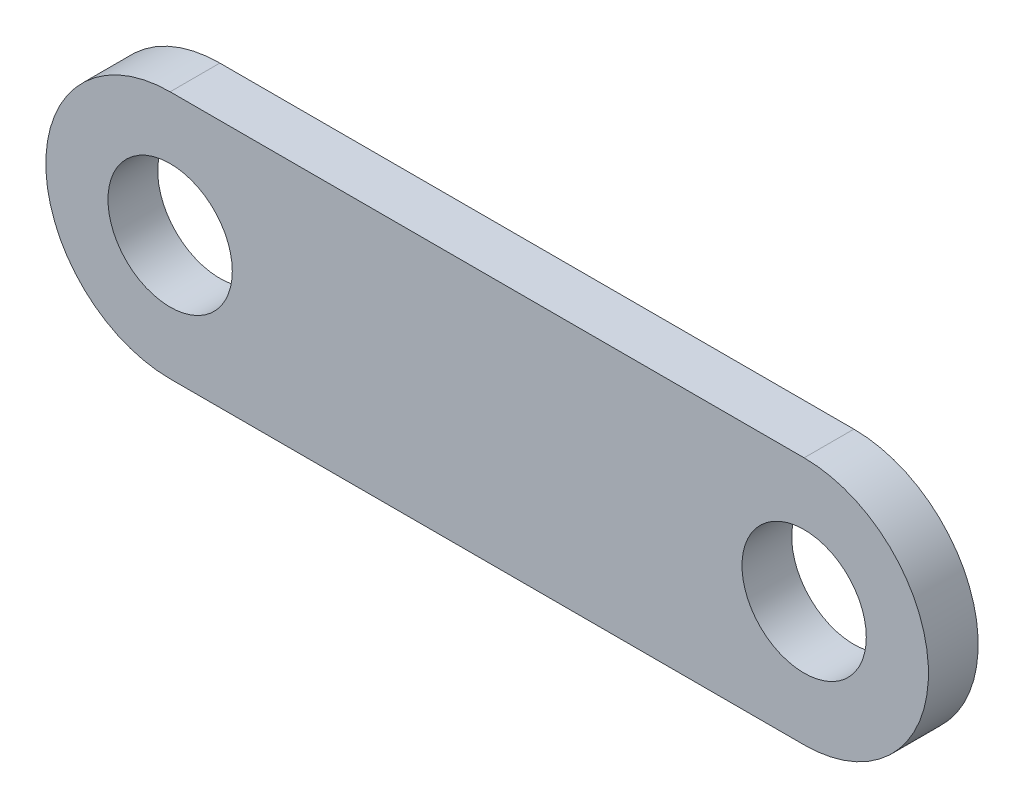
from build123d import *

# Parameters (mm, degrees)
SKETCH1_R           = 25
BOSS_EXTRUDE1_DEPTH = 10


with BuildPart() as part:
    # Sketch1 → Boss-Extrude1 (new, symmetric)
    with BuildSketch(Plane.XY):
        with BuildLine():
            Line((0, 50), (255, 50))
            ThreePointArc((255, 50), (305, 0), (255, -50))
            Line((255, -50), (0, -50))
            ThreePointArc((0, -50), (-50, 0), (0, 50))
        make_face()
        Circle(SKETCH1_R, mode=Mode.SUBTRACT)
        with Locations((255, 0)):
            Circle(SKETCH1_R, mode=Mode.SUBTRACT)
    extrude(amount=BOSS_EXTRUDE1_DEPTH, both=True)


solid = part.part
